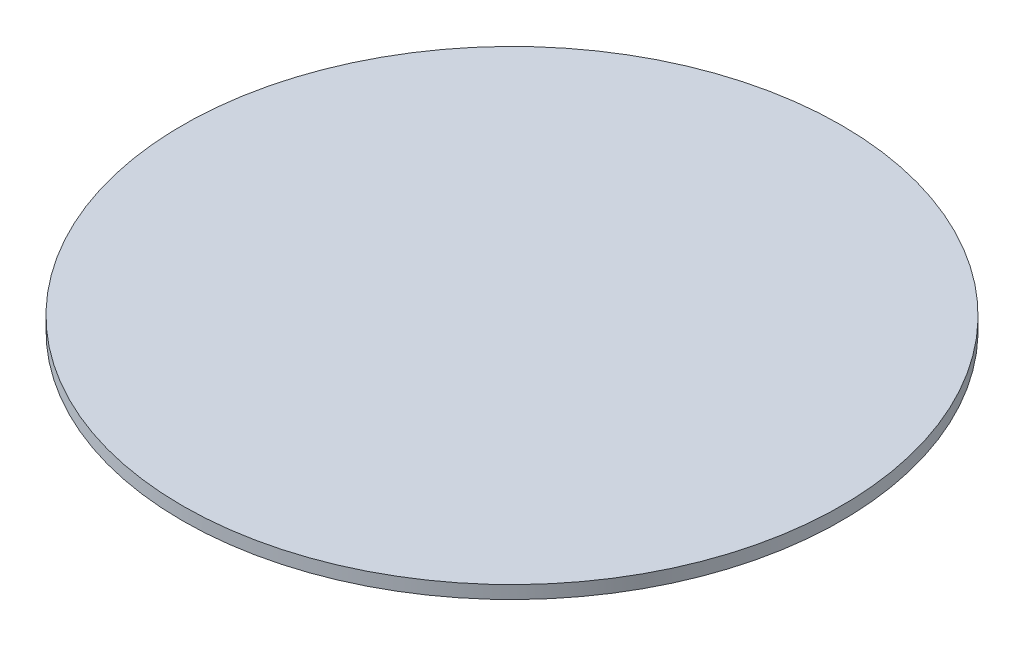
from build123d import *

# Parameters (mm, degrees)
SKETCH1_R           = 12.7
BOSS_EXTRUDE1_DEPTH = 0.5


with BuildPart() as part:
    # Sketch1 → Boss-Extrude1 (new body)
    with BuildSketch(Plane(origin=(0, 0, 0), x_dir=(1, 0, 0), z_dir=(0, 1, 0))):
        with Locations(Location((0, 0, 0), (0, 0, 270))):
            Circle(SKETCH1_R)
    extrude(amount=BOSS_EXTRUDE1_DEPTH)


solid = part.part
